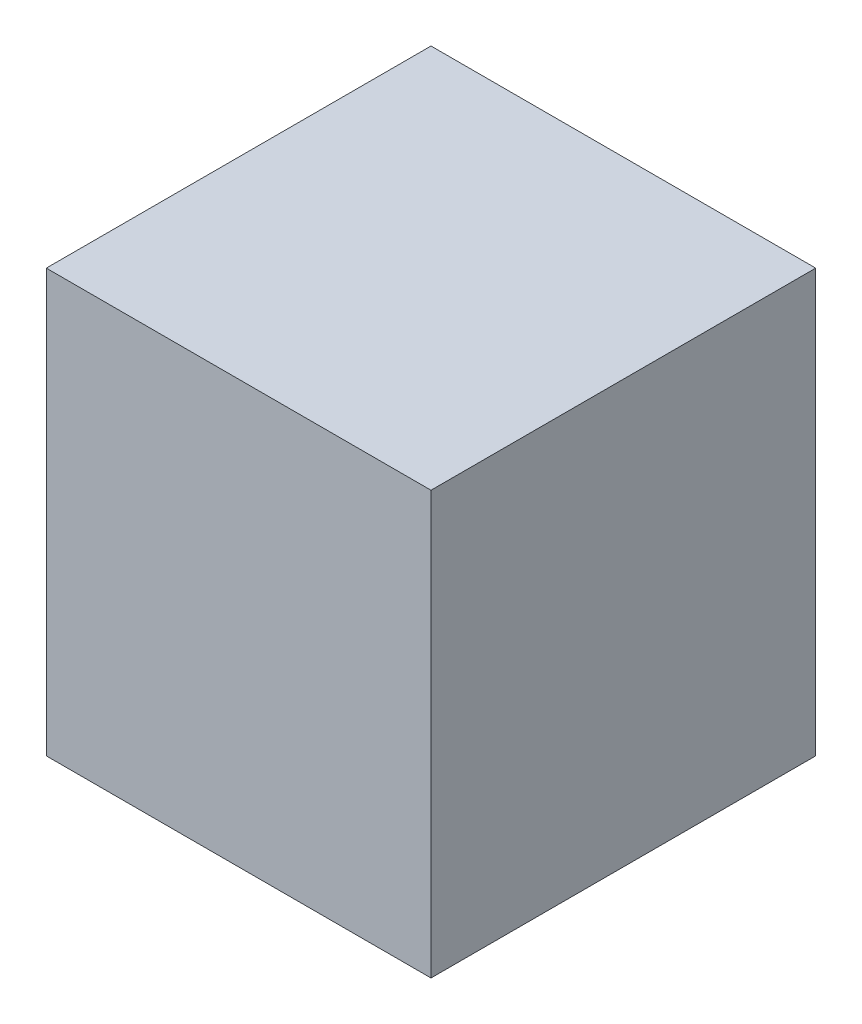
from build123d import *

# Parameters (mm, degrees)
SKETCH1_W           = 51
SKETCH1_H           = 51
BOSS_EXTRUDE1_DEPTH = 56


with BuildPart() as part:
    # Sketch1 → Boss-Extrude1 (new body)
    with BuildSketch(Plane(origin=(0, 0, 0), x_dir=(1, 0, 0), z_dir=(0, 1, 0))):
        Rectangle(SKETCH1_W, SKETCH1_H)
    extrude(amount=BOSS_EXTRUDE1_DEPTH)


solid = part.part
